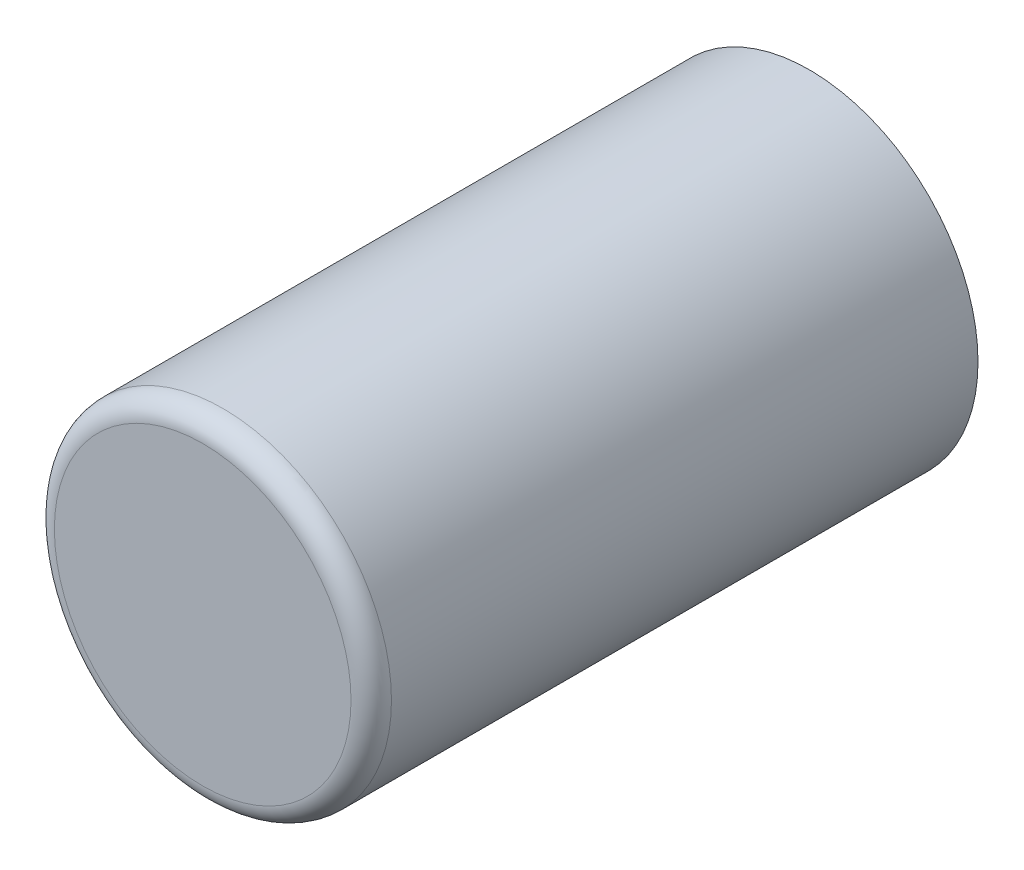
from build123d import *

# Parameters (mm, degrees)
SKETCH1_R           = 2.5
BOSS_EXTRUDE1_DEPTH = 9
FILLET1_R           = 0.3
SKETCH2_W           = 3
SKETCH2_H           = 3
CUT_EXTRUDE1_DEPTH  = 4


with BuildPart() as part:
    # Sketch1 → Boss-Extrude1 (new body)
    with BuildSketch(Plane.XY):
        Circle(SKETCH1_R)
    extrude(amount=BOSS_EXTRUDE1_DEPTH)

    # Fillet1
    fillet1_edges = [part.edges().sort_by_distance(p)[0] for p in [
        (-2.5, 0, 9),
    ]]
    fillet(fillet1_edges, radius=FILLET1_R)

    # Sketch2 → Cut-Extrude1 (cut)
    with BuildSketch(Plane(origin=(0, 0, 0), x_dir=(-1, 0, 0), z_dir=(0, 0, -1))):
        Rectangle(SKETCH2_W, SKETCH2_H)
    extrude(amount=-CUT_EXTRUDE1_DEPTH, mode=Mode.SUBTRACT)


solid = part.part
